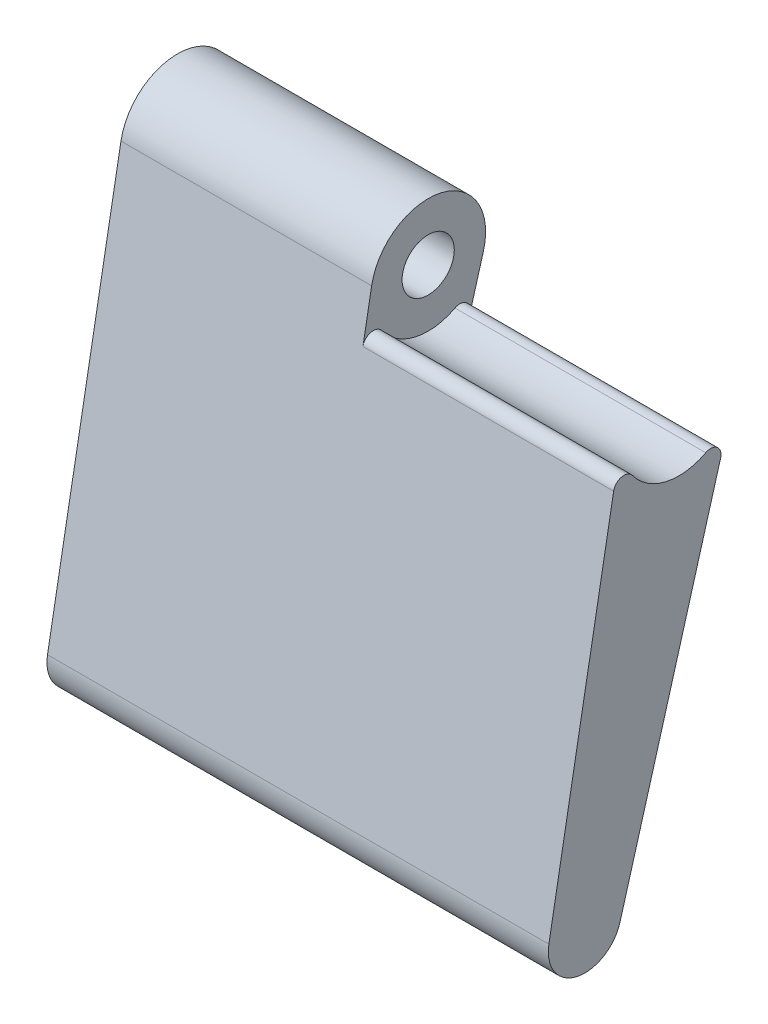
from build123d import *

# Parameters (mm, degrees)
SKETCH_1_R          = 0.625
EXTRUDE_1_DEPTH     = 12
CUT_EXTRUDE_START   = -6
SKETCH_2_R          = 1.375
CUT_EXTRUDE_1_DEPTH = 6
CUT_EXTRUDE_2_DEPTH = 6


with BuildPart() as part:
    # 草图1 → 凸台-拉伸1 (new body)
    with BuildSketch(Plane(origin=(63.25, 0, 0), x_dir=(0, 0, -1), z_dir=(1, 0, 0))):
        with BuildLine():
            Line((-79.908766601, -63.245730904), (-77.178061801, -53.70329142))
            ThreePointArc((-77.178061801, -53.70329142), (-78.188696573, -51.985703477), (-79.853262586, -53.081473056))
            Line((-79.853262586, -53.081473056), (-81.6111671, -62.850028308))
            ThreePointArc((-81.6111671, -62.850028308), (-80.948102181, -63.857279605), (-79.908766601, -63.245730904))
        make_face()
        with Locations((-78.5, -53.325)):
            Circle(SKETCH_1_R, mode=Mode.SUBTRACT)
    extrude(amount=-EXTRUDE_1_DEPTH)

    # 草图2 → 切除-拉伸1 (cut)
    with BuildSketch(Plane(origin=(63.25, 0, 0), x_dir=(0, 0, -1), z_dir=(1, 0, 0)).offset(CUT_EXTRUDE_START)):
        with Locations((-78.5, -53.325)):
            Circle(SKETCH_2_R)
    extrude(amount=CUT_EXTRUDE_1_DEPTH, mode=Mode.SUBTRACT)

    # 草图3 → 切除-拉伸2 (cut)
    with BuildSketch(Plane(origin=(63.25, 0, 0), x_dir=(0, 0, -1), z_dir=(1, 0, 0)).offset(CUT_EXTRUDE_START)):
        with BuildLine():
            Line((-79.853262586, -53.081473056), (-80.060943062, -54.235539267))
            ThreePointArc((-80.060943062, -54.235539267), (-79.870673692, -54.036118774), (-79.612603732, -54.132921987))
            ThreePointArc((-79.612603732, -54.132921987), (-79.840339654, -53.631781049), (-79.853262586, -53.081473056))
        make_face()
        with BuildLine():
            ThreePointArc((-77.178061801, -53.70329142), (-77.432371823, -54.191484319), (-77.857788029, -54.540807873))
            ThreePointArc((-77.857788029, -54.540807873), (-77.583479618, -54.567749621), (-77.500669801, -54.83064408))
            Line((-77.500669801, -54.83064408), (-77.178061801, -53.70329142))
        make_face()
    extrude(amount=CUT_EXTRUDE_2_DEPTH, mode=Mode.SUBTRACT)


solid = part.part
